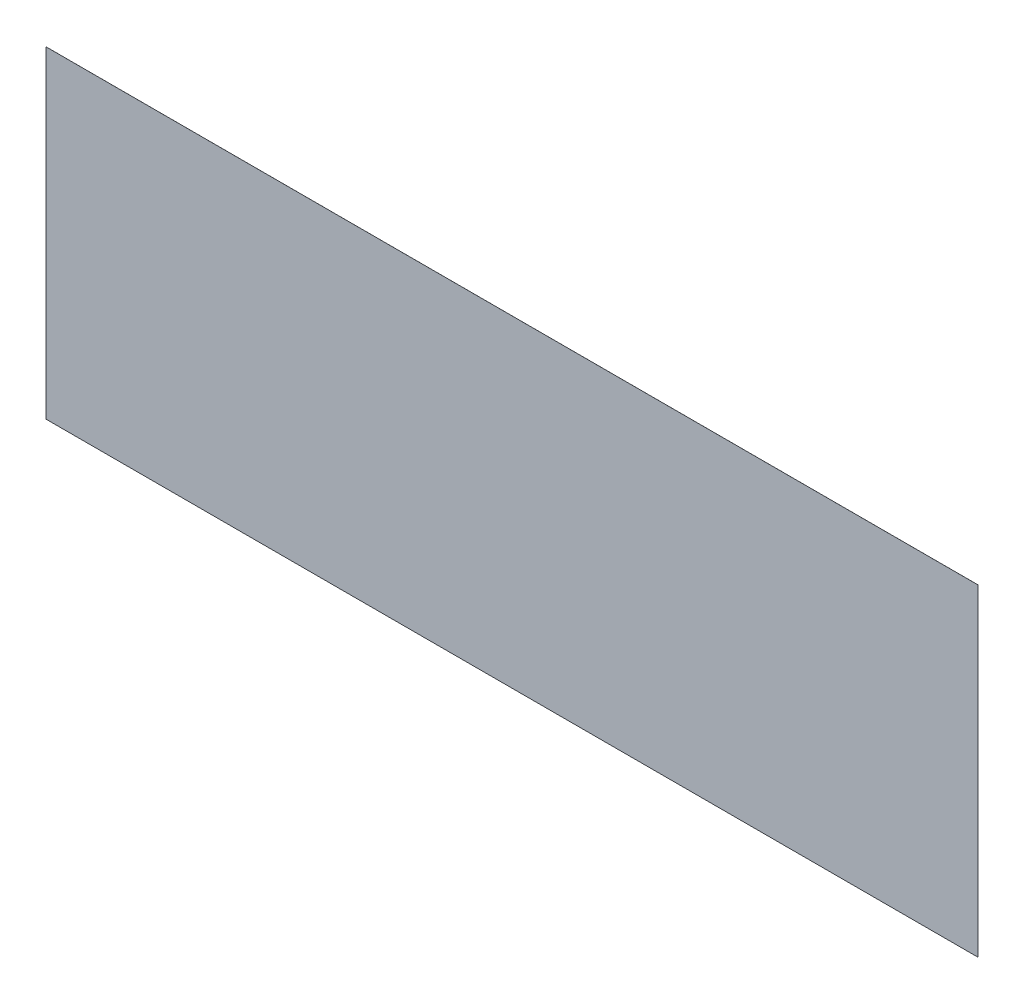
from build123d import *

# Parameters (mm, degrees)
SKETCH2_W           = 2890
SKETCH2_H           = 1000
BOSS_EXTRUDE1_DEPTH = 0.1


with BuildPart() as part:
    # Sketch2 → Boss-Extrude1 (new body)
    with BuildSketch(Plane.XY):
        with Locations((1445, -500)):
            Rectangle(SKETCH2_W, SKETCH2_H)
    extrude(amount=BOSS_EXTRUDE1_DEPTH)


solid = part.part
